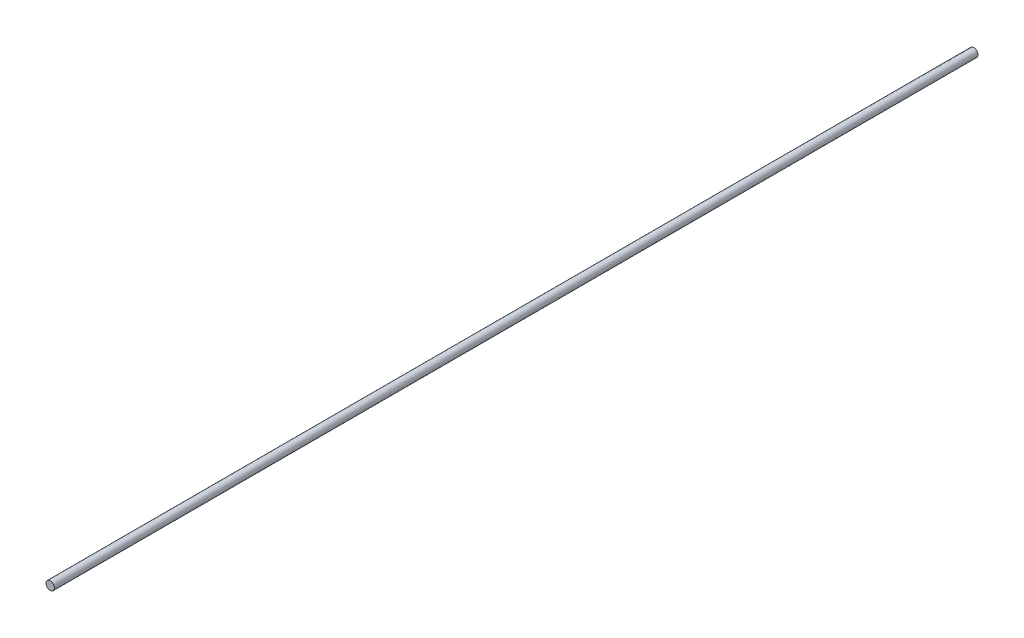
from build123d import *

# Parameters (mm, degrees)
SKETCH1_R           = 1.5
BOSS_EXTRUDE1_DEPTH = 330.5988


with BuildPart() as part:
    # Sketch1 → Boss-Extrude1 (new body)
    with BuildSketch(Plane.XY):
        Circle(SKETCH1_R)
    extrude(amount=BOSS_EXTRUDE1_DEPTH)


solid = part.part
